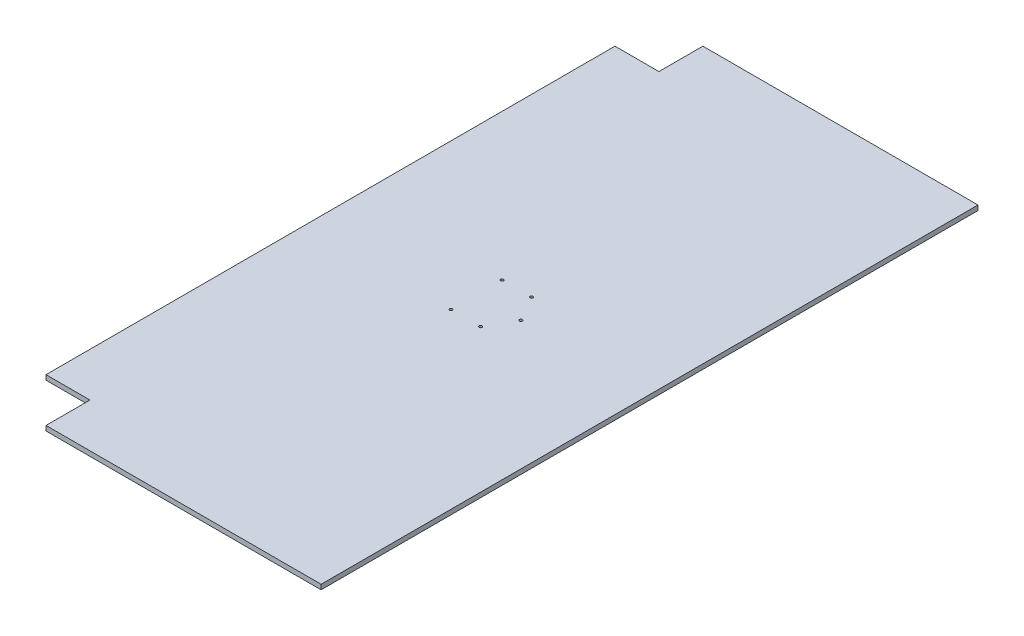
from build123d import *

# Parameters (mm, degrees)
BOSS_EXTRUDE1_DEPTH = 9
SKETCH2_W           = 14
SKETCH2_H           = 1225
CUT_EXTRUDE1_DEPTH  = 10
SKETCH3_W           = 82
SKETCH3_H           = 82
CUT_EXTRUDE5_DEPTH  = 10
SKETCH4_R           = 2.75
CUT_EXTRUDE6_DEPTH  = 10


with BuildPart() as part:
    # Sketch1 → Boss-Extrude1 (new body)
    with BuildSketch(Plane(origin=(0, 0, 0), x_dir=(1, 0, 0), z_dir=(0, 1, 0))):
        Polygon((-304.5, -532.5), (-304.5, -612.5), (224.5, -612.5), (304.5, -612.5), (304.5, -532.5), (304.5, 497.5), (304.5, 612.5), (224.5, 612.5), (-304.5, 612.5), (-304.5, 497.5), align=None)
    extrude(amount=BOSS_EXTRUDE1_DEPTH)

    # Sketch2 → Cut-Extrude1 (cut)
    with BuildSketch(Plane(origin=(0, 9, 0), x_dir=(1, 0, 0), z_dir=(0, 1, 0))):
        with Locations((297.5, 0)):
            Rectangle(SKETCH2_W, SKETCH2_H)
    extrude(amount=-CUT_EXTRUDE1_DEPTH, mode=Mode.SUBTRACT)

    # Sketch3 → Cut-Extrude5 (cut)
    with BuildSketch(Plane(origin=(0, 9, 0), x_dir=(1, 0, 0), z_dir=(0, 1, 0))):
        with Locations((-263.5, 571.5)):
            Rectangle(SKETCH3_W, SKETCH3_H)
        with Locations((-263.5, -571.5)):
            Rectangle(SKETCH3_W, SKETCH3_H)
    extrude(amount=-CUT_EXTRUDE5_DEPTH, mode=Mode.SUBTRACT)

    # Sketch4 → Cut-Extrude6 (cut)
    with BuildSketch(Plane(origin=(0, 9, 0), x_dir=(1, 0, 0), z_dir=(0, 1, 0))):
        with Locations(Location((23, 47.631397208, 0), (0, 0, 270))):
            Circle(SKETCH4_R)
        with Locations(Location((-32, -47.631397208, 0), (0, 0, 270))):
            Circle(SKETCH4_R)
        with Locations(Location((23, -47.631397208, 0), (0, 0, 270))):
            Circle(SKETCH4_R)
        with Locations(Location((50.5, 0, 0), (0, 0, 270))):
            Circle(SKETCH4_R)
        with Locations(Location((-32, 47.631397208, 0), (0, 0, 270))):
            Circle(SKETCH4_R)
    extrude(amount=-CUT_EXTRUDE6_DEPTH, mode=Mode.SUBTRACT)


solid = part.part
